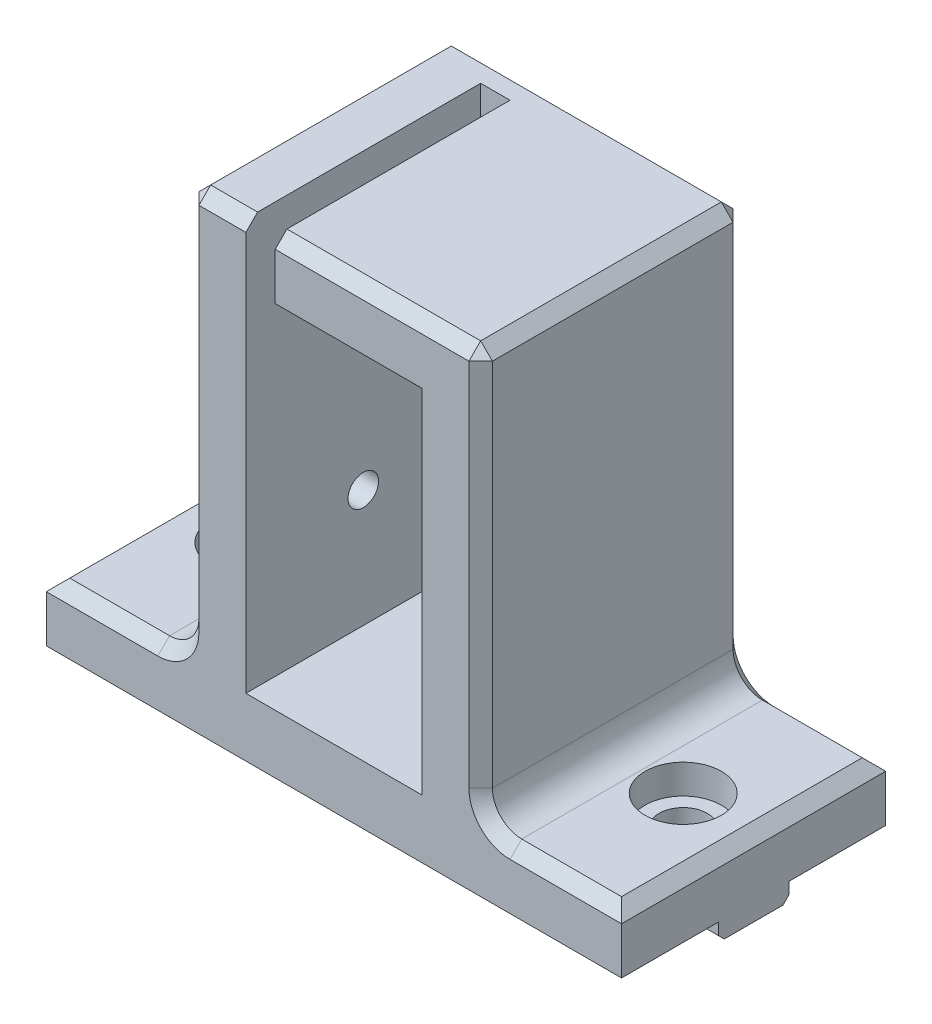
from build123d import *

# Parameters (mm, degrees)
BOSS_EXTRUDE1_DEPTH     = 40
CUT_EXTRUDE1_START      = 10
SKETCH2_R               = 2.6
CUT_EXTRUDE1_DEPTH      = 113.46950766
SKETCH9_W               = 50
SKETCH9_H               = 80
BOSS_EXTRUDE2_DEPTH     = 5
SKETCH11_W              = 24
SKETCH11_H              = 45
BOSS_EXTRUDE3_DEPTH     = 10
CUT_EXTRUDE2_DEPTH      = 117.086174887
CUT_EXTRUDE2_DEPTH_BACK = 117.086174887
SKETCH12_R              = 4.1
CUT_EXTRUDE3_START      = 10
SKETCH13_R              = 6.5
CUT_EXTRUDE3_DEPTH      = 5
FILLET2_R               = 5
CHAMFER1_SIZE           = 2
SKETCH14_W              = 98
SKETCH14_H              = 12
BOSS_EXTRUDE4_DEPTH     = 3
CUT_EXTRUDE4_DEPTH      = 117.086174887
CUT_EXTRUDE4_DEPTH_BACK = 117.086174887
SKETCH12_2_R            = 4.1
CHAMFER2_SIZE           = 1


with BuildPart() as part:
    # Sketch1 → Boss-Extrude1 (new body)
    with BuildSketch(Plane.XY):
        Polygon((0, 0), (0, 80), (10, 80), (10, 10), (40, 10), (40, 70), (15, 70), (15, 80), (50, 80), (50, 0), align=None)
    extrude(amount=BOSS_EXTRUDE1_DEPTH)

    # Sketch2 → Cut-Extrude1 (cut, through all)
    with BuildSketch(Plane(origin=(0, 0, 0), x_dir=(0, 0, -1), z_dir=(1, 0, 0)).offset(CUT_EXTRUDE1_START)):
        with Locations(Location((-20, 30, 0), (0, 0, 270))):
            Circle(SKETCH2_R)
    extrude(amount=-CUT_EXTRUDE1_DEPTH, mode=Mode.SUBTRACT)

    # Sketch9 → Boss-Extrude2 (add)
    with BuildSketch(Plane.XY):
        with Locations((25, 40)):
            Rectangle(SKETCH9_W, SKETCH9_H)
    extrude(amount=-BOSS_EXTRUDE2_DEPTH)

    # Sketch11 → Boss-Extrude3 (add)
    with BuildSketch(Plane(origin=(0, 0, 0), x_dir=(1, 0, 0), z_dir=(0, 1, 0))):
        with Locations((62, -17.5)):
            Rectangle(SKETCH11_W, SKETCH11_H)
        with Locations((-12, -17.5)):
            Rectangle(SKETCH11_W, SKETCH11_H)
    extrude(amount=BOSS_EXTRUDE3_DEPTH)

    # Sketch12 → Cut-Extrude2 (cut, two sides: drawn at the far end of the back side and taken through both)
    with BuildSketch(Plane(origin=(0, 0, 0), x_dir=(1, 0, 0), z_dir=(0, 1, 0)).offset(-CUT_EXTRUDE2_DEPTH_BACK)):
        with Locations(Location((-12, -17.5, 0), (0, 0, 90))):
            Circle(SKETCH12_R)
        with Locations(Location((62, -17.5, 0), (0, 0, 90))):
            Circle(SKETCH12_R)
    extrude(amount=CUT_EXTRUDE2_DEPTH + CUT_EXTRUDE2_DEPTH_BACK, mode=Mode.SUBTRACT)

    # Sketch13 → Cut-Extrude3 (cut)
    with BuildSketch(Plane(origin=(0, 0, 0), x_dir=(1, 0, 0), z_dir=(0, 1, 0)).offset(CUT_EXTRUDE3_START)):
        with Locations(Location((-12, -17.5, 0), (0, 0, 90))):
            Circle(SKETCH13_R)
        with Locations(Location((62, -17.5, 0), (0, 0, 90))):
            Circle(SKETCH13_R)
    extrude(amount=-CUT_EXTRUDE3_DEPTH, mode=Mode.SUBTRACT)

    # Fillet2
    fillet2_edges = [part.edges().sort_by_distance(p)[0] for p in [
        (0, 10, 17.5),
        (50, 10, 17.5),
    ]]
    fillet(fillet2_edges, radius=FILLET2_R)

    # Chamfer1
    chamfer1_edges = [part.edges().sort_by_distance(p)[0] for p in [
        (-14.5, 10, 40),
        (51.464466094, 11.464466094, -5),
        (51.464466094, 11.464466094, 40),
        (-1.464466094, 11.464466094, 40),
        (-1.464466094, 11.464466094, -5),
        (32.5, 80, 40),
        (0, 80, 17.5),
        (50, 80, 17.5),
        (25, 80, -5),
        (0, 47.5, -5),
        (5, 80, 40),
        (0, 47.5, 40),
        (-24, 10, 17.5),
        (-14.5, 10, -5),
        (74, 10, 17.5),
        (64.5, 10, 40),
        (50, 47.5, 40),
        (50, 47.5, -5),
        (64.5, 10, -5),
    ]]
    chamfer(chamfer1_edges, length=CHAMFER1_SIZE)

    # Sketch14 → Boss-Extrude4 (add)
    with BuildSketch(Plane(origin=(0, 0, 0), x_dir=(1, 0, 0), z_dir=(0, 1, 0))):
        with Locations((25, -17.5)):
            Rectangle(SKETCH14_W, SKETCH14_H)
    extrude(amount=-BOSS_EXTRUDE4_DEPTH)

    # Sketch12<2> → Cut-Extrude4 (cut, two sides: drawn at the far end of the back side and taken through both)
    with BuildSketch(Plane(origin=(0, 0, 0), x_dir=(1, 0, 0), z_dir=(0, 1, 0)).offset(-CUT_EXTRUDE4_DEPTH_BACK)):
        with Locations(Location((-12, -17.5, 0), (0, 0, 90))):
            Circle(SKETCH12_2_R)
        with Locations(Location((62, -17.5, 0), (0, 0, 90))):
            Circle(SKETCH12_2_R)
    extrude(amount=CUT_EXTRUDE4_DEPTH + CUT_EXTRUDE4_DEPTH_BACK, mode=Mode.SUBTRACT)

    # Chamfer2
    chamfer2_edges = [part.edges().sort_by_distance(p)[0] for p in [
        (25, -3, 11.5),
        (25, -3, 23.5),
    ]]
    chamfer(chamfer2_edges, length=CHAMFER2_SIZE)


solid = part.part
